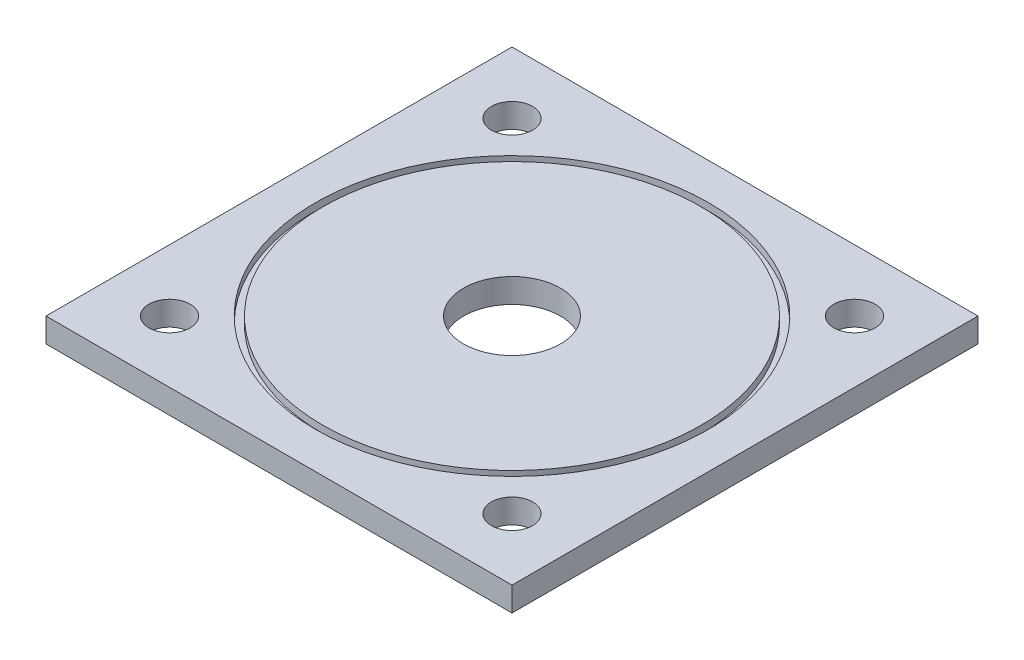
from build123d import *

# Parameters (mm, degrees)
SKETCH1_W                           = 96.210678118
SKETCH1_H                           = 96.210678118
SKETCH1_R                           = 4.25
BODY_EXTRUSION_AND_BOLT_HOLES_DEPTH = 5
SKETCH3_R                           = 10
CENTER_BORE_DEPTH                   = 22.5
SKETCH4_R                           = 40.558917197
SKETCH4_R_2                         = 39.058917197
O_RING_GROOVE_DEPTH                 = 1.5
CUT_EXTRUDE2_START                  = -1.5
SKETCH6_R                           = 40.558917197
SKETCH6_R_2                         = 39.058917197
CUT_EXTRUDE2_DEPTH                  = 1.5


with BuildPart() as part:
    # Sketch1 → body extrusion and bolt holes (new body)
    with BuildSketch(Plane(origin=(0, 0, 0), x_dir=(1, 0, 0), z_dir=(0, 1, 0))):
        Rectangle(SKETCH1_W, SKETCH1_H)
        with Locations(Location((-35.355339059, 35.355339059, 0), (0, 0, 270))):
            Circle(SKETCH1_R, mode=Mode.SUBTRACT)
        with Locations(Location((35.355339059, 35.355339059, 0), (0, 0, 270))):
            Circle(SKETCH1_R, mode=Mode.SUBTRACT)
        with Locations(Location((35.355339059, -35.355339059, 0), (0, 0, 270))):
            Circle(SKETCH1_R, mode=Mode.SUBTRACT)
        with Locations(Location((-35.355339059, -35.355339059, 0), (0, 0, 270))):
            Circle(SKETCH1_R, mode=Mode.SUBTRACT)
    extrude(amount=BODY_EXTRUSION_AND_BOLT_HOLES_DEPTH)

    # Sketch3 → center bore (cut)
    with BuildSketch(Plane(origin=(0, 5, 0), x_dir=(1, 0, 0), z_dir=(0, 1, 0))):
        with Locations(Location((0, 0, 0), (0, 0, 270))):
            Circle(SKETCH3_R)
    extrude(amount=-CENTER_BORE_DEPTH, mode=Mode.SUBTRACT)

    # Sketch4 → o-ring groove (cut)
    with BuildSketch(Plane(origin=(0, 5, 0), x_dir=(1, 0, 0), z_dir=(0, 1, 0))):
        with Locations(Location((0, 0, 0), (0, 0, 270))):
            Circle(SKETCH4_R)
        with Locations(Location((0, 0, 0), (0, 0, 270))):
            Circle(SKETCH4_R_2, mode=Mode.SUBTRACT)
    extrude(amount=-O_RING_GROOVE_DEPTH, mode=Mode.SUBTRACT)

    # Sketch6 → Cut-Extrude2 (cut)
    with BuildSketch(Plane.XZ.offset(CUT_EXTRUDE2_START)):
        with Locations(Location((0, 0, 0), (0, 0, 90))):
            Circle(SKETCH6_R)
        with Locations(Location((0, 0, 0), (0, 0, 90))):
            Circle(SKETCH6_R_2, mode=Mode.SUBTRACT)
    extrude(amount=CUT_EXTRUDE2_DEPTH, mode=Mode.SUBTRACT)


solid = part.part
